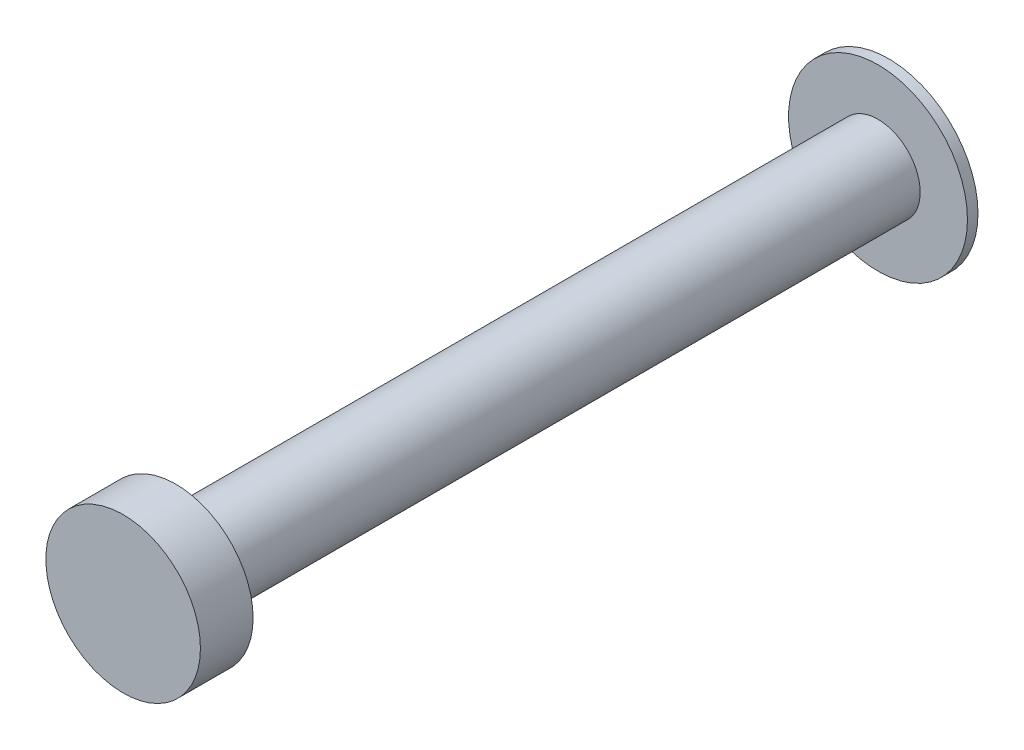
from build123d import *


with BuildPart() as part:
    # Sketch1 → Revolve1 (revolve)
    with BuildSketch(Plane(origin=(0, 0, 0), x_dir=(1, 0, 0), z_dir=(0, 1, 0))):
        Polygon((-124.4203125, -21.53523125), (-108.2532125, -21.53523125), (-108.2532125, -23.44023125), (-116.8003125, -23.44023125), (-116.8003125, -150.36403125), (-110.4503125, -150.36403125), (-110.4503125, -159.88903125), (-124.4203125, -159.88903125), align=None)
    revolve(axis=Axis((-124.4203125, 0, 159.88903125), (0, 0, -1)))


solid = part.part
